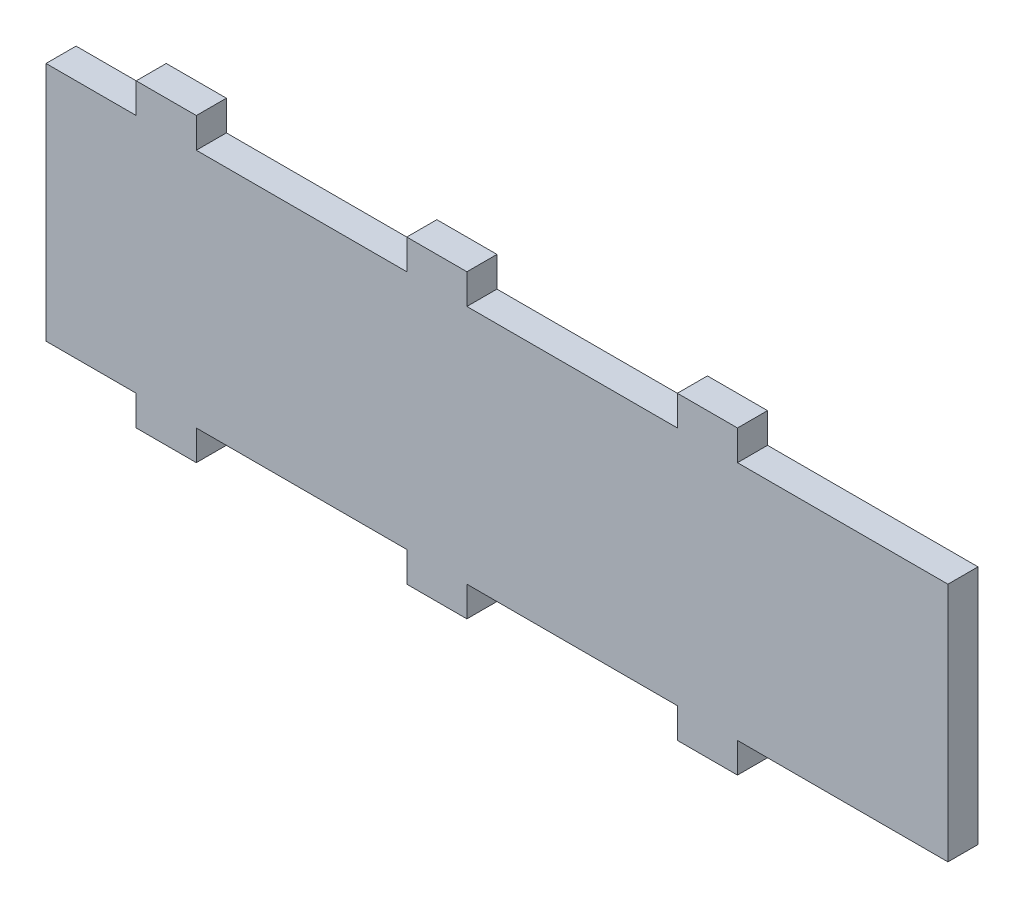
from build123d import *

# Parameters (mm, degrees)
BOSS_EXTRU_1_DEPTH = 5


with BuildPart() as part:
    # Esquisse1 → Boss.-Extru.1 (new body)
    with BuildSketch(Plane.XY):
        Polygon((0, 0), (15, 0), (15, -5), (25, -5), (25, 0), (60, 0), (60, -5), (70, -5), (70, 0), (105, 0), (105, -5), (115, -5), (115, 0), (150, 0), (150, 40), (115, 40), (115, 45), (105, 45), (105, 40), (70, 40), (70, 45), (60, 45), (60, 40), (25, 40), (25, 45), (15, 45), (15, 40), (0, 40), align=None)
    extrude(amount=BOSS_EXTRU_1_DEPTH)


solid = part.part
